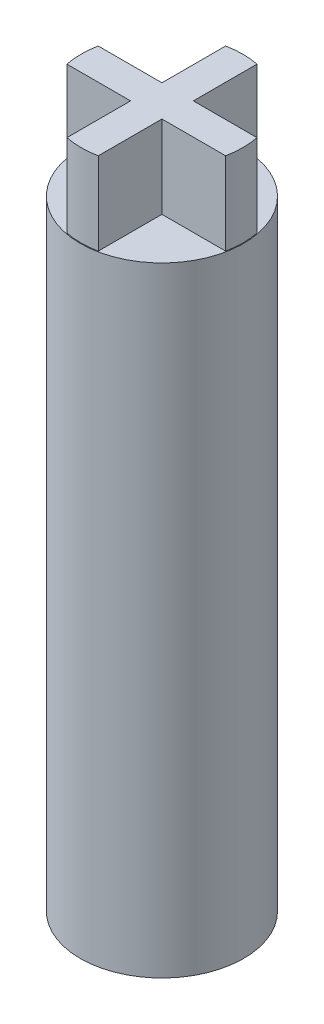
from build123d import *

# Parameters (mm, degrees)
SKETCH3_R           = 9.9
BOSS_EXTRUDE1_DEPTH = 75
CUT_EXTRUDE8_DEPTH  = 10.2
CUT_EXTRUDE9_DEPTH  = 4.2
SKETCH7_7_R         = 4.7
CUT_EXTRUDE10_DEPTH = 2.2
BOSS_EXTRUDE3_START = 10
BOSS_EXTRUDE3_DEPTH = 10
CUT_EXTRUDE11_DEPTH = 10


with BuildPart() as part:
    # Sketch3 → Boss-Extrude1 (new body)
    with BuildSketch(Plane(origin=(0, 0, 0), x_dir=(1, 0, 0), z_dir=(0, 1, 0))):
        Circle(SKETCH3_R)
    extrude(amount=-BOSS_EXTRUDE1_DEPTH)

    # Sketch7 → Cut-Extrude8 (cut)
    with BuildSketch(Plane(origin=(0, -75, 0), x_dir=(-1, 0, 0), z_dir=(0, -1, 0))):
        with BuildLine():
            Line((-1.62, 2.16), (-1.62, -2.16))
            ThreePointArc((-1.62, -2.16), (0, -2.7), (1.62, -2.16))
            Line((1.62, -2.16), (1.62, 2.16))
            ThreePointArc((1.62, 2.16), (0, 2.7), (-1.62, 2.16))
        make_face()
    extrude(amount=-CUT_EXTRUDE8_DEPTH, mode=Mode.SUBTRACT)

    # Sketch7<6> → Cut-Extrude9 (cut)
    with BuildSketch(Plane(origin=(0, -75, 0), x_dir=(-1, 0, 0), z_dir=(0, -1, 0))):
        with BuildLine():
            ThreePointArc((-1.62, 2.16), (-2.7, 0), (-1.62, -2.16))
            Line((-1.62, -2.16), (-1.62, 2.16))
        make_face()
        with BuildLine():
            Line((1.62, 2.16), (1.62, -2.16))
            ThreePointArc((1.62, -2.16), (2.7, 0), (1.62, 2.16))
        make_face()
    extrude(amount=-CUT_EXTRUDE9_DEPTH, mode=Mode.SUBTRACT)

    # Sketch7<7> → Cut-Extrude10 (cut)
    with BuildSketch(Plane(origin=(0, -75, 0), x_dir=(-1, 0, 0), z_dir=(0, -1, 0))):
        Circle(SKETCH7_7_R)
        with BuildLine():
            ThreePointArc((-2.16, -1.62), (-2.7, 0), (-2.16, 1.62))
            ThreePointArc((-2.16, 1.62), (-1.909188309, 1.909188309), (-1.62, 2.16))
            ThreePointArc((-1.62, 2.16), (0, 2.7), (1.62, 2.16))
            ThreePointArc((1.62, 2.16), (1.909188309, 1.909188309), (2.16, 1.62))
            ThreePointArc((2.16, 1.62), (2.561444905, 0.853814968), (2.7, 0))
            ThreePointArc((2.7, 0), (2.561444905, -0.853814968), (2.16, -1.62))
            ThreePointArc((2.16, -1.62), (1.909188309, -1.909188309), (1.62, -2.16))
            ThreePointArc((1.62, -2.16), (0, -2.7), (-1.62, -2.16))
            ThreePointArc((-1.62, -2.16), (-1.909188309, -1.909188309), (-2.16, -1.62))
        make_face(mode=Mode.SUBTRACT)
    extrude(amount=-CUT_EXTRUDE10_DEPTH, mode=Mode.SUBTRACT)

    # Sketch5 → Boss-Extrude3 (add)
    with BuildSketch(Plane(origin=(0, 0, 0), x_dir=(1, 0, 0), z_dir=(0, 1, 0)).offset(BOSS_EXTRUDE3_START)):
        with BuildLine():
            Line((-2, 9.695875412), (-2, 2))
            Line((-2, 2), (-9.695875412, 2))
            ThreePointArc((-9.695875412, 2), (-9.9, 0), (-9.695875412, -2))
            Line((-9.695875412, -2), (-2, -2))
            Line((-2, -2), (-2, -9.695875412))
            ThreePointArc((-2, -9.695875412), (0, -9.9), (2, -9.695875412))
            Line((2, -9.695875412), (2, -2))
            Line((2, -2), (9.695875412, -2))
            ThreePointArc((9.695875412, -2), (9.848836646, -1.005194863), (9.9, 0))
            ThreePointArc((9.9, 0), (9.848836646, 1.005194863), (9.695875412, 2))
            Line((9.695875412, 2), (2, 2))
            Line((2, 2), (2, 9.695875412))
            ThreePointArc((2, 9.695875412), (0, 9.9), (-2, 9.695875412))
        make_face()
    extrude(amount=-BOSS_EXTRUDE3_DEPTH)

    # Sketch11 → Cut-Extrude11 (cut)
    with BuildSketch(Plane(origin=(0, 10, 0), x_dir=(1, 0, 0), z_dir=(0, 1, 0))):
        with BuildLine():
            Line((-2, 9.695875412), (-2, 2))
            Line((-2, 2), (-9.695875412, 2))
            ThreePointArc((-9.695875412, 2), (-9.9, 0), (-9.695875412, -2))
            Line((-9.695875412, -2), (-2, -2))
            Line((-2, -2), (-2, -9.695875412))
            ThreePointArc((-2, -9.695875412), (0, -9.9), (2, -9.695875412))
            Line((2, -9.695875412), (2, -2))
            Line((2, -2), (9.695875412, -2))
            ThreePointArc((9.695875412, -2), (9.9, 0), (9.695875412, 2))
            Line((9.695875412, 2), (2, 2))
            Line((2, 2), (2, 9.695875412))
            ThreePointArc((2, 9.695875412), (0, 9.9), (-2, 9.695875412))
        make_face()
        with BuildLine():
            ThreePointArc((-1.9, 9.614052215), (0, 9.8), (1.9, 9.614052215))
            Line((1.9, 9.614052215), (1.9, 1.9))
            Line((1.9, 1.9), (9.614052215, 1.9))
            ThreePointArc((9.614052215, 1.9), (9.8, 0), (9.614052215, -1.9))
            Line((9.614052215, -1.9), (1.9, -1.9))
            Line((1.9, -1.9), (1.9, -9.614052215))
            ThreePointArc((1.9, -9.614052215), (0, -9.8), (-1.9, -9.614052215))
            Line((-1.9, -9.614052215), (-1.9, -1.9))
            Line((-1.9, -1.9), (-9.614052215, -1.9))
            ThreePointArc((-9.614052215, -1.9), (-9.8, 0), (-9.614052215, 1.9))
            Line((-9.614052215, 1.9), (-1.9, 1.9))
            Line((-1.9, 1.9), (-1.9, 9.614052215))
        make_face(mode=Mode.SUBTRACT)
    extrude(amount=-CUT_EXTRUDE11_DEPTH, mode=Mode.SUBTRACT)


solid = part.part
